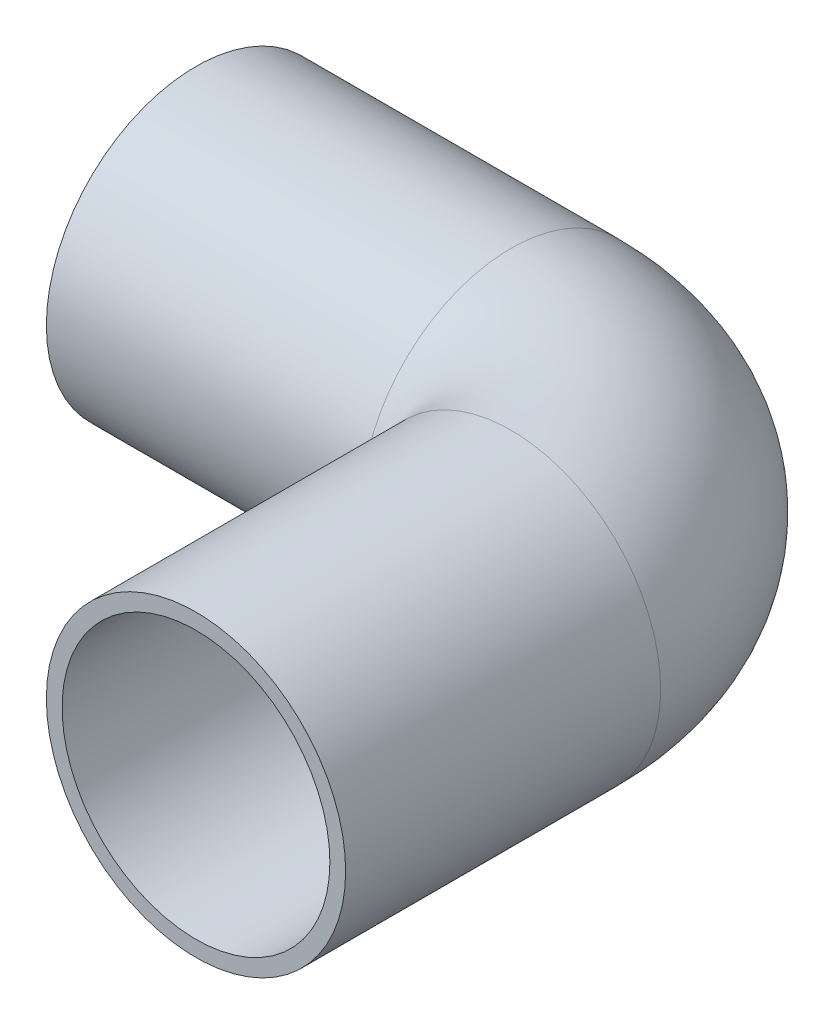
from build123d import *

# Parameters (mm, degrees)
SKETCH1_R   = 19
SKETCH1_R_2 = 17


with BuildPart() as part:
    # Sweep1: sweep along a path in Sketch2
    with BuildLine(Plane(origin=(0, 0, 0), x_dir=(1, 0, 0), z_dir=(0, 1, 0))) as sweep1_path:
        Line((0, 0), (0, 40))
        ThreePointArc((0, 40), (-5.857864376, 54.142135624), (-20, 60))
        Line((-20, 60), (-60, 60))
    # Sketch1 → Sweep1 (sweep)
    with BuildSketch(Plane.XY):
        Circle(SKETCH1_R)
        Circle(SKETCH1_R_2, mode=Mode.SUBTRACT)
    sweep(path=sweep1_path.line)


solid = part.part
